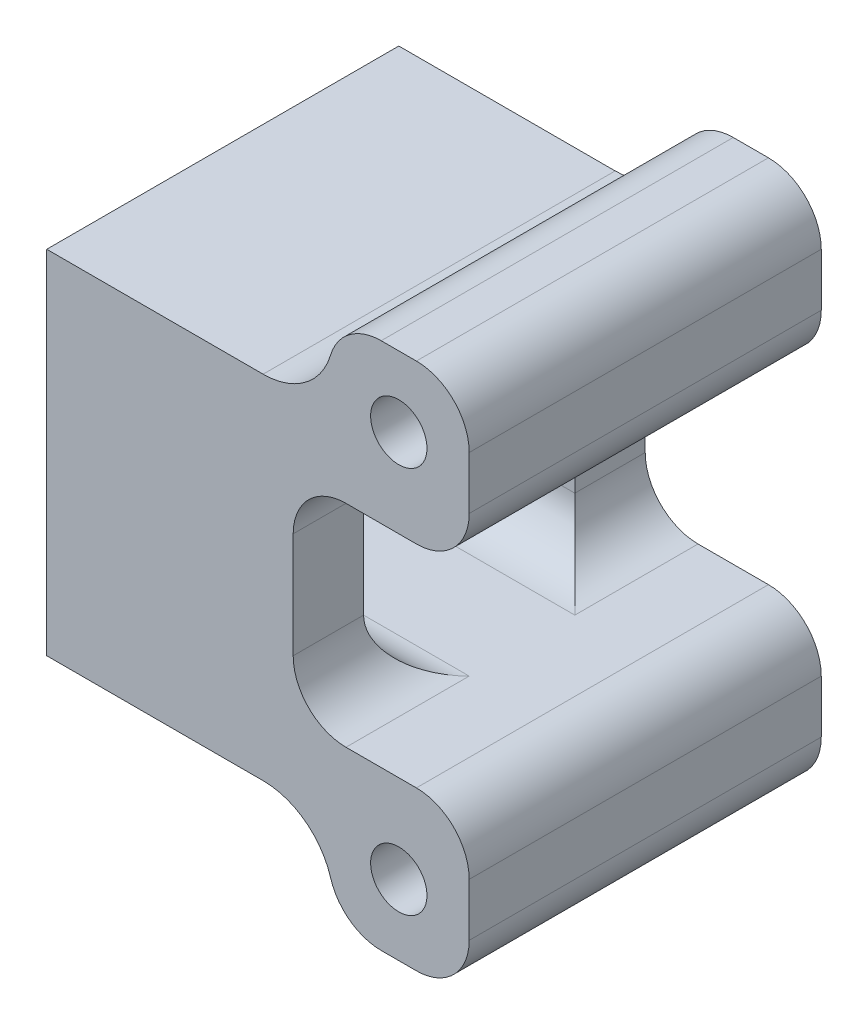
from build123d import *

# Parameters (mm, degrees)
SKETCH1_W           = 20
SKETCH1_H           = 20
BOSS_EXTRUDE1_DEPTH = 4
SKETCH2_R           = 3.7
CUT_EXTRUDE1_DEPTH  = 2.6
SKETCH3_R           = 2.1
CUT_EXTRUDE2_DEPTH  = 29.403520909
SKETCH4_W           = 12
SKETCH4_H           = 4
BOSS_EXTRUDE2_DEPTH = 10
SKETCH7_W           = 20
SKETCH7_H           = 4
BOSS_EXTRUDE3_DEPTH = 10
SKETCH8_W           = 8
SKETCH8_H           = 20
BOSS_EXTRUDE4_DEPTH = 5
SKETCH9_W           = 8
SKETCH9_H           = 20
BOSS_EXTRUDE5_DEPTH = 5
SKETCH10_R          = 1.6
CUT_EXTRUDE5_DEPTH  = 41.012498047
FILLET6_R           = 3
FILLET7_R           = 3
FILLET8_R           = 4


with BuildPart() as part:
    # Sketch1 → Boss-Extrude1 (new body)
    with BuildSketch(Plane(origin=(0, 0, 0), x_dir=(0, 0, -1), z_dir=(1, 0, 0))):
        with Locations((-10, -10)):
            Rectangle(SKETCH1_W, SKETCH1_H)
    extrude(amount=BOSS_EXTRUDE1_DEPTH)

    # Sketch2 → Cut-Extrude1 (cut)
    with BuildSketch(Plane(origin=(4, 0, 0), x_dir=(0, 0, -1), z_dir=(1, 0, 0))):
        with Locations((-10, -10)):
            Circle(SKETCH2_R)
    extrude(amount=-CUT_EXTRUDE1_DEPTH, mode=Mode.SUBTRACT)

    # Sketch3 → Cut-Extrude2 (cut, through all)
    with BuildSketch(Plane(origin=(1.4, 0, 0), x_dir=(0, 0, -1), z_dir=(1, 0, 0))):
        with Locations((-10, -10)):
            Circle(SKETCH3_R)
    extrude(amount=-CUT_EXTRUDE2_DEPTH, mode=Mode.SUBTRACT)

    # Sketch4 → Boss-Extrude2 (add)
    with BuildSketch(Plane(origin=(4, 0, 0), x_dir=(0, 0, -1), z_dir=(1, 0, 0))):
        Polygon((-20, 0), (-20, -20), (-16, -20), (-16, -16), (-16, -4), (-16, 0), align=None)
        with Locations((-10, -18)):
            Rectangle(SKETCH4_W, SKETCH4_H)
        Polygon((-4, -16), (-4, -20), (0, -20), (0, -4), (-4, -4), align=None)
        Polygon((0, 0), (-16, 0), (-16, -4), (-4, -4), (0, -4), align=None)
    extrude(amount=BOSS_EXTRUDE2_DEPTH)

    # Sketch7 → Boss-Extrude3 (add)
    with BuildSketch(Plane(origin=(14, 0, 0), x_dir=(0, 0, -1), z_dir=(1, 0, 0))):
        with Locations((-10, -18)):
            Rectangle(SKETCH7_W, SKETCH7_H)
        with Locations((-10, -2)):
            Rectangle(SKETCH7_W, SKETCH7_H)
    extrude(amount=BOSS_EXTRUDE3_DEPTH)

    # Sketch8 → Boss-Extrude4 (add)
    with BuildSketch(Plane(origin=(0, -20, 0), x_dir=(-1, 0, 0), z_dir=(0, -1, 0))):
        with Locations((-20, -10)):
            Rectangle(SKETCH8_W, SKETCH8_H)
    extrude(amount=BOSS_EXTRUDE4_DEPTH)

    # Sketch9 → Boss-Extrude5 (add)
    with BuildSketch(Plane(origin=(0, 0, 0), x_dir=(1, 0, 0), z_dir=(0, 1, 0))):
        with Locations((20, -10)):
            Rectangle(SKETCH9_W, SKETCH9_H)
    extrude(amount=BOSS_EXTRUDE5_DEPTH)

    # Sketch10 → Cut-Extrude5 (cut, through all)
    with BuildSketch(Plane(origin=(0, 0, 0), x_dir=(-1, 0, 0), z_dir=(0, 0, -1))):
        with Locations(Location((-20, 1, 0), (0, 0, 90))):
            Circle(SKETCH10_R)
        with Locations(Location((-20, -21, 0), (0, 0, 90))):
            Circle(SKETCH10_R)
    extrude(amount=-CUT_EXTRUDE5_DEPTH, mode=Mode.SUBTRACT)

    # Fillet6
    fillet6_edges = [part.edges().sort_by_distance(p)[0] for p in [
        (24, -16, 10),
        (24, -4, 10),
        (24, -25, 10),
        (16, -25, 10),
        (24, 5, 10),
        (16, 5, 10),
    ]]
    fillet(fillet6_edges, radius=FILLET6_R)

    # Fillet7
    fillet7_edges = [part.edges().sort_by_distance(p)[0] for p in [
        (9, -4, 16),
        (9, -4, 4),
        (9, -16, 4),
        (9, -16, 16),
        (14, -16, 18),
        (14, -16, 2),
        (14, -4, 2),
        (14, -4, 18),
    ]]
    fillet(fillet7_edges, radius=FILLET7_R)

    # Fillet8
    fillet8_edges = [part.edges().sort_by_distance(p)[0] for p in [
        (16, -20, 10),
        (16, 0, 10),
    ]]
    fillet(fillet8_edges, radius=FILLET8_R)


solid = part.part
